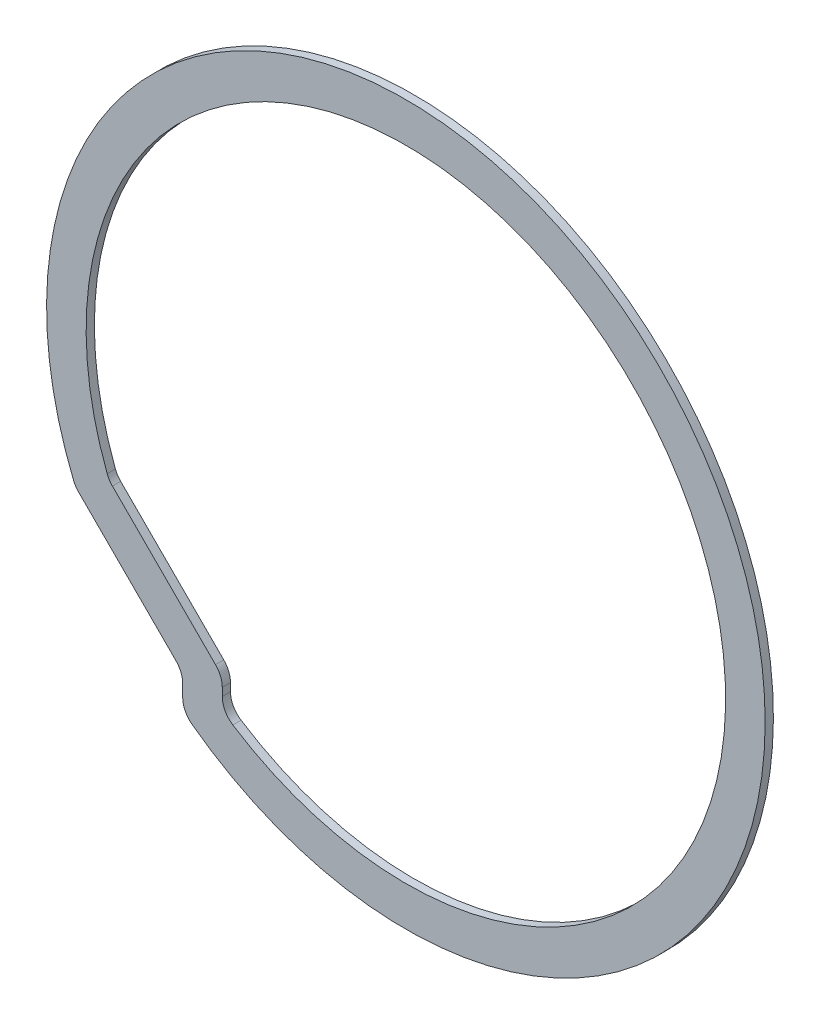
from build123d import *

# Parameters (mm, degrees)
BOSS_EXTRUDE1_DEPTH = 1.5875
CUT_EXTRUDE1_DEPTH  = 3.175
FILLET1_R           = 8.89


with BuildPart() as part:
    # Sketch1 → Boss-Extrude1 (new, symmetric)
    with BuildSketch(Plane.XY):
        with BuildLine():
            Line((-127.293308919, -32.555250036), (-85.984130762, -73.864428193))
            Line((-85.984130762, -73.864428193), (-85.984130762, -86.643760402))
            ThreePointArc((-85.984130762, -86.643760402), (-70.818680903, -97.099597285), (-54.399250036, -105.449308919))
            ThreePointArc((-54.399250036, -105.449308919), (97.88479172, 119.72879172), (-127.293308919, -32.555250036))
        make_face()
    extrude(amount=BOSS_EXTRUDE1_DEPTH, both=True)

    # Sketch2 → Cut-Extrude1 (cut)
    with BuildSketch(Plane.XY.offset(1.5875)):
        with BuildLine():
            Line((-114.372852664, -23.923091601), (-70.744130762, -67.551813503))
            Line((-70.744130762, -67.551813503), (-70.744130762, -79.00759425))
            ThreePointArc((-70.744130762, -79.00759425), (96.569405073, 98.330117066), (-114.372852664, -23.923091601))
        make_face()
    extrude(amount=-CUT_EXTRUDE1_DEPTH, mode=Mode.SUBTRACT)

    # Fillet1
    fillet1_edges = [part.edges().sort_by_distance(p)[0] for p in [
        (-114.372852664, -23.923091601, 0),
        (-70.744130762, -79.00759425, 0),
        (-70.744130762, -67.551813503, 0),
        (-85.984130762, -86.643760402, -0.79375),
        (-85.984130762, -73.864428193, -0.79375),
        (-127.293308919, -32.555250036, -0.79375),
    ]]
    fillet(fillet1_edges, radius=FILLET1_R)


solid = part.part
